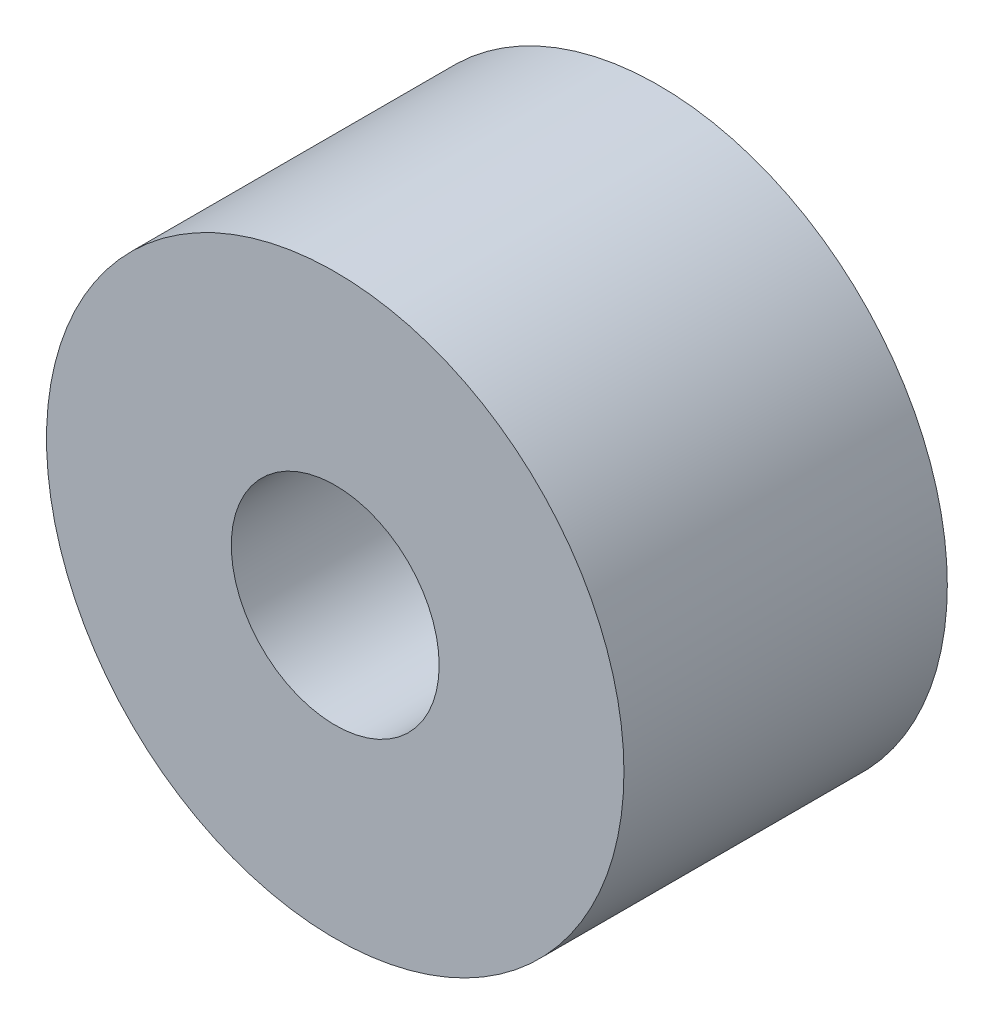
from build123d import *

# Parameters (mm, degrees)
ESBO_O1_R                = 12.5
ESBO_O1_R_2              = 4.5
RESSALTO_EXTRUS_O1_DEPTH = 14


with BuildPart() as part:
    # Esboço1 → Ressalto-extrusão1 (new body)
    with BuildSketch(Plane.XY):
        Circle(ESBO_O1_R)
        Circle(ESBO_O1_R_2, mode=Mode.SUBTRACT)
    extrude(amount=RESSALTO_EXTRUS_O1_DEPTH)


solid = part.part
